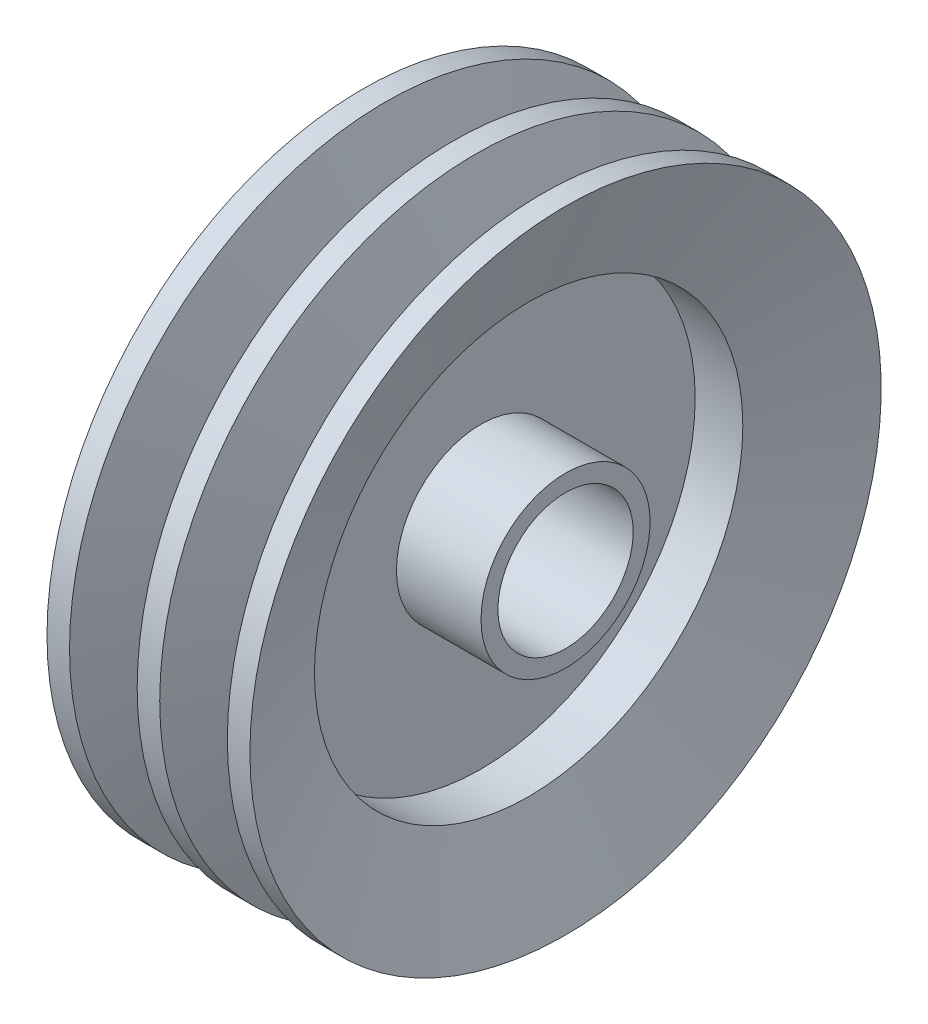
from build123d import *


with BuildPart() as part:
    # Croquis1 → Revolución1 (revolve)
    with BuildSketch(Plane(origin=(0, 0, 0), x_dir=(1, 0, 0), z_dir=(0, 1, 0)), mode=Mode.PRIVATE) as revoluci_n1_sk:
        Polygon((-5, 110), (5, 110), (15.919107028, 80), (24.080892972, 80), (35, 110), (45, 110), (28.621339458, 65), (7.5, 65), (7.5, 7.5), (45, 7.5), (45, 0), (-45, 0), (-45, 7.5), (-7.5, 7.5), (-7.5, 65), (-28.621339458, 65), (-45, 110), (-35, 110), (-24.080892972, 80), (-15.919107028, 80), align=None)
    revolve(revoluci_n1_sk.sketch.rotate(Axis((-45, 0, 30), (1, 0, 0)), 180), axis=Axis((-45, 0, 30), (1, 0, 0)))


solid = part.part
